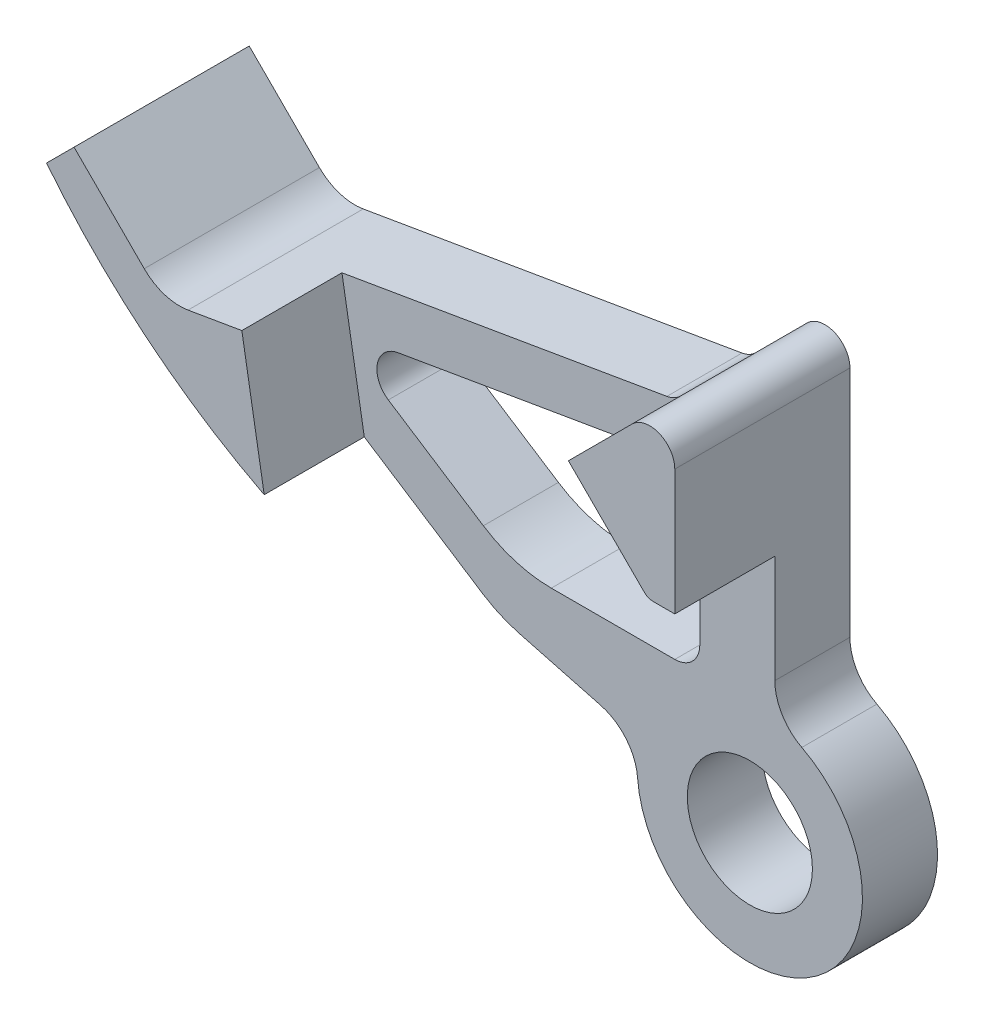
from build123d import *

# Parameters (mm, degrees)
ESQUISSE1_R          = 2.5
BASE_EXTRUSION_DEPTH = 3
BOSS_EXTRU_1_DEPTH   = 7


with BuildPart() as part:
    # Esquisse1 → Base-Extrusion (new body)
    with BuildSketch(Plane.XY):
        with BuildLine():
            Line((-10.667800722, 2.931775933), (-19.844250261, 8.864938219))
            ThreePointArc((-19.844250261, 8.864938219), (-20.280859603, 9.905812475), (-19.469453705, 10.690457238))
            Line((-19.469453705, 10.690457238), (-3.313828745, 13.446463599))
            ThreePointArc((-3.313828745, 13.446463599), (-3.022713301, 13.543930034), (-2.774883777, 13.725116223))
            Line((-2.774883777, 13.725116223), (-0.707106781, 15.792893219))
            ThreePointArc((-0.707106781, 15.792893219), (0.382683432, 16.00966597), (1, 15.085786438))
            Line((1, 15.085786438), (1, 5.766281297))
            ThreePointArc((1, 5.766281297), (1.290299171, 4.728532254), (2.076923077, 3.992040898))
            ThreePointArc((2.076923077, 3.992040898), (2.481066389, -3.75423888), (-4.486704107, -0.345667841))
            ThreePointArc((-4.486704107, -0.345667841), (-4.944162699, 0.780843297), (-5.969520458, 1.434247592))
            Line((-5.969520458, 1.434247592), (-9.231194787, 2.296710044))
            ThreePointArc((-9.231194787, 2.296710044), (-9.974591181, 2.557478226), (-10.667800722, 2.931775933))
        make_face()
        Circle(ESQUISSE1_R, mode=Mode.SUBTRACT)
        with BuildLine():
            Line((-2, 9.15321079), (-2, 5.5))
            ThreePointArc((-2, 5.5), (-2.292893219, 4.792893219), (-3, 4.5))
            Line((-3, 4.5), (-7.934127615, 4.5))
            ThreePointArc((-7.934127615, 4.5), (-9.349403144, 4.704481761), (-10.648919459, 5.301201929))
            Line((-10.648919459, 5.301201929), (-14.446834044, 7.756796926))
            ThreePointArc((-14.446834044, 7.756796926), (-14.883443387, 8.797671182), (-14.072037489, 9.582315945))
            Line((-14.072037489, 9.582315945), (-4.37665324, 11.236262526))
            ThreePointArc((-4.37665324, 11.236262526), (-3.033695989, 10.992947624), (-2.159511991, 9.944835677))
            Line((-2.159511991, 9.944835677), (-2.119182379, 9.833302751))
            ThreePointArc((-2.119182379, 9.833302751), (-2.030020908, 9.4984388), (-2, 9.15321079))
        make_face(mode=Mode.SUBTRACT)
    extrude(amount=BASE_EXTRUSION_DEPTH)

    # Esquisse2 → Boss.-Extru.1 (add)
    with BuildSketch(Plane(origin=(0, 0, 0), x_dir=(-1, 0, 0), z_dir=(0, 0, -1))):
        with BuildLine():
            Line((0.707106781, 15.792893219), (3.25, 13.25))
            Line((3.25, 13.25), (0.218577995, 10.218577995))
            ThreePointArc((0.218577995, 10.218577995), (0.056366321, 10.110191619), (-0.134975396, 10.072131386))
            Line((-0.134975396, 10.072131386), (-1, 10.072131386))
            Line((-1, 10.072131386), (-1, 15.085786438))
            ThreePointArc((-1, 15.085786438), (-0.382683432, 16.00966597), (0.707106781, 15.792893219))
        make_face()
        with BuildLine():
            Line((16.3, 11.231137936), (15.406918032, 5.995918767))
            ThreePointArc((15.406918032, 5.995918767), (20.133394575, 9.10050758), (24.105145399, 13.125833357))
            Line((24.105145399, 13.125833357), (23.004987611, 14.225991144))
            Line((23.004987611, 14.225991144), (20.200649548, 11.421653081))
            ThreePointArc((20.200649548, 11.421653081), (19.393155824, 10.930114551), (18.450112359, 10.864347833))
            Line((18.450112359, 10.864347833), (16.3, 11.231137936))
        make_face()
    extrude(amount=-BOSS_EXTRU_1_DEPTH)


solid = part.part
